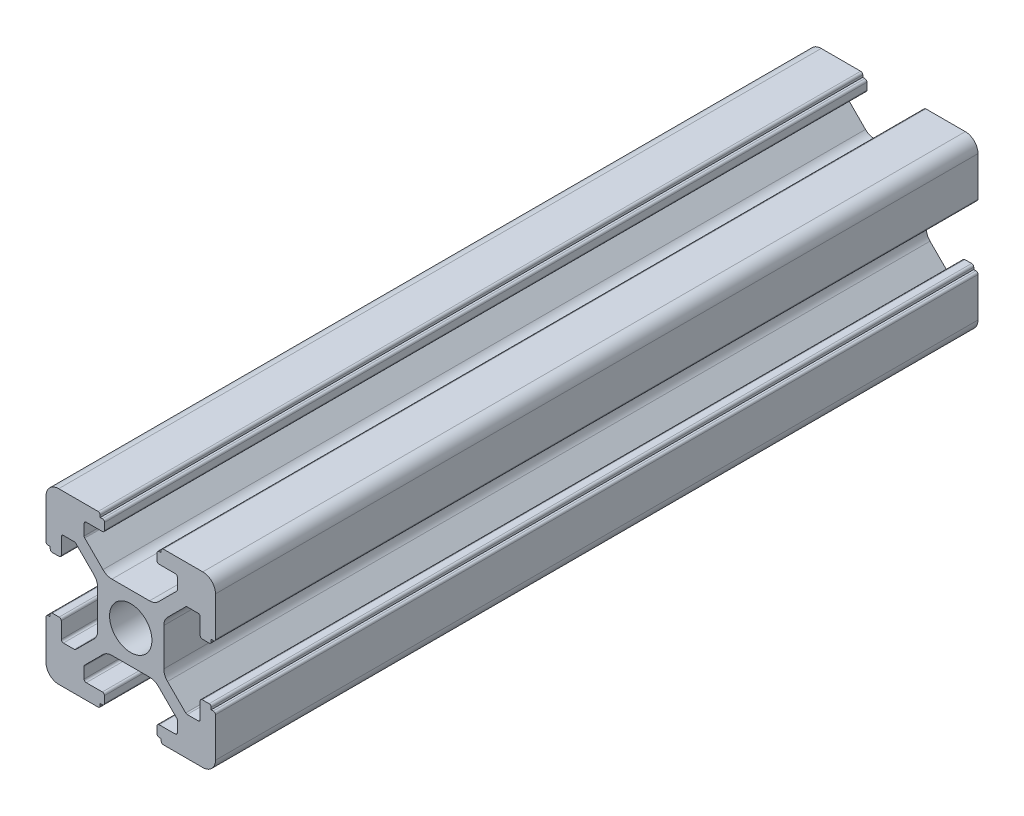
from build123d import *

# Parameters (mm, degrees)
SKETCH_1_R      = 2.5
EXTRUDE_1_DEPTH = 45


with BuildPart() as part:
    # 草图1 → 凸台-拉伸1 (new, symmetric)
    with BuildSketch(Plane.XY):
        with BuildLine():
            Line((-8.502261885, -10.002261885), (-3.85, -10.002261885))
            ThreePointArc((-3.85, -10.002261885), (-3.673223305, -9.929038581), (-3.6, -9.752261885))
            Line((-3.6, -9.752261885), (-3.6, -9.502261885))
            Line((-3.6, -9.502261885), (-3.35, -9.502261885))
            ThreePointArc((-3.35, -9.502261885), (-3.173223305, -9.429038581), (-3.1, -9.252261885))
            Line((-3.1, -9.252261885), (-3.1, -8.45))
            ThreePointArc((-3.1, -8.45), (-3.173223305, -8.273223305), (-3.35, -8.2))
            Line((-3.35, -8.2), (-5.25, -8.2))
            ThreePointArc((-5.25, -8.2), (-5.426776695, -8.126776695), (-5.5, -7.95))
            Line((-5.5, -7.95), (-5.5, -6.664213562))
            ThreePointArc((-5.5, -6.664213562), (-5.480969883, -6.568542704), (-5.426776695, -6.487436867))
            Line((-5.426776695, -6.487436867), (-3.278679656, -4.339339828))
            ThreePointArc((-3.278679656, -4.339339828), (-2.792044633, -4.014180701), (-2.218019485, -3.9))
            Line((-2.218019485, -3.9), (2.218019485, -3.9))
            ThreePointArc((2.218019485, -3.9), (2.792044633, -4.014180701), (3.278679656, -4.339339828))
            Line((3.278679656, -4.339339828), (5.426776695, -6.487436867))
            ThreePointArc((5.426776695, -6.487436867), (5.480969883, -6.568542704), (5.5, -6.664213562))
            Line((5.5, -6.664213562), (5.5, -7.95))
            ThreePointArc((5.5, -7.95), (5.426776695, -8.126776695), (5.25, -8.2))
            Line((5.25, -8.2), (3.35, -8.2))
            ThreePointArc((3.35, -8.2), (3.173223305, -8.273223305), (3.1, -8.45))
            Line((3.1, -8.45), (3.1, -9.252261885))
            ThreePointArc((3.1, -9.252261885), (3.173223305, -9.429038581), (3.35, -9.502261885))
            Line((3.35, -9.502261885), (3.6, -9.502261885))
            Line((3.6, -9.502261885), (3.6, -9.752261885))
            ThreePointArc((3.6, -9.752261885), (3.673223305, -9.929038581), (3.85, -10.002261885))
            Line((3.85, -10.002261885), (8.502261885, -10.002261885))
            ThreePointArc((8.502261885, -10.002261885), (9.562922057, -9.562922057), (10.002261885, -8.502261885))
            Line((10.002261885, -8.502261885), (10.002261885, -3.85))
            ThreePointArc((10.002261885, -3.85), (9.929038581, -3.673223305), (9.752261885, -3.6))
            Line((9.752261885, -3.6), (9.502261885, -3.6))
            Line((9.502261885, -3.6), (9.502261885, -3.35))
            ThreePointArc((9.502261885, -3.35), (9.429038581, -3.173223305), (9.252261885, -3.1))
            Line((9.252261885, -3.1), (8.45, -3.1))
            ThreePointArc((8.45, -3.1), (8.273223305, -3.173223305), (8.2, -3.35))
            Line((8.2, -3.35), (8.2, -5.25))
            ThreePointArc((8.2, -5.25), (8.126776695, -5.426776695), (7.95, -5.5))
            Line((7.95, -5.5), (6.664213562, -5.5))
            ThreePointArc((6.664213562, -5.5), (6.568542704, -5.480969883), (6.487436867, -5.426776695))
            Line((6.487436867, -5.426776695), (4.339339828, -3.278679656))
            ThreePointArc((4.339339828, -3.278679656), (4.014180701, -2.792044633), (3.9, -2.218019485))
            Line((3.9, -2.218019485), (3.9, 2.218019485))
            ThreePointArc((3.9, 2.218019485), (4.014180701, 2.792044633), (4.339339828, 3.278679656))
            Line((4.339339828, 3.278679656), (6.487436867, 5.426776695))
            ThreePointArc((6.487436867, 5.426776695), (6.568542704, 5.480969883), (6.664213562, 5.5))
            Line((6.664213562, 5.5), (7.95, 5.5))
            ThreePointArc((7.95, 5.5), (8.126776695, 5.426776695), (8.2, 5.25))
            Line((8.2, 5.25), (8.2, 3.35))
            ThreePointArc((8.2, 3.35), (8.273223305, 3.173223305), (8.45, 3.1))
            Line((8.45, 3.1), (9.252261885, 3.1))
            ThreePointArc((9.252261885, 3.1), (9.429038581, 3.173223305), (9.502261885, 3.35))
            Line((9.502261885, 3.35), (9.502261885, 3.6))
            Line((9.502261885, 3.6), (9.752261885, 3.6))
            ThreePointArc((9.752261885, 3.6), (9.929038581, 3.673223305), (10.002261885, 3.85))
            Line((10.002261885, 3.85), (10.002261885, 8.502261885))
            ThreePointArc((10.002261885, 8.502261885), (9.562922057, 9.562922057), (8.502261885, 10.002261885))
            Line((8.502261885, 10.002261885), (3.85, 10.002261885))
            ThreePointArc((3.85, 10.002261885), (3.673223305, 9.929038581), (3.6, 9.752261885))
            Line((3.6, 9.752261885), (3.6, 9.502261885))
            Line((3.6, 9.502261885), (3.35, 9.502261885))
            ThreePointArc((3.35, 9.502261885), (3.173223305, 9.429038581), (3.1, 9.252261885))
            Line((3.1, 9.252261885), (3.1, 8.45))
            ThreePointArc((3.1, 8.45), (3.173223305, 8.273223305), (3.35, 8.2))
            Line((3.35, 8.2), (5.25, 8.2))
            ThreePointArc((5.25, 8.2), (5.426776695, 8.126776695), (5.5, 7.95))
            Line((5.5, 7.95), (5.5, 6.664213562))
            ThreePointArc((5.5, 6.664213562), (5.480969883, 6.568542704), (5.426776695, 6.487436867))
            Line((5.426776695, 6.487436867), (3.278679656, 4.339339828))
            ThreePointArc((3.278679656, 4.339339828), (2.792044633, 4.014180701), (2.218019485, 3.9))
            Line((2.218019485, 3.9), (-2.218019485, 3.9))
            ThreePointArc((-2.218019485, 3.9), (-2.792044633, 4.014180701), (-3.278679656, 4.339339828))
            Line((-3.278679656, 4.339339828), (-5.426776695, 6.487436867))
            ThreePointArc((-5.426776695, 6.487436867), (-5.480969883, 6.568542704), (-5.5, 6.664213562))
            Line((-5.5, 6.664213562), (-5.5, 7.95))
            ThreePointArc((-5.5, 7.95), (-5.426776695, 8.126776695), (-5.25, 8.2))
            Line((-5.25, 8.2), (-3.35, 8.2))
            ThreePointArc((-3.35, 8.2), (-3.173223305, 8.273223305), (-3.1, 8.45))
            Line((-3.1, 8.45), (-3.1, 9.252261885))
            ThreePointArc((-3.1, 9.252261885), (-3.173223305, 9.429038581), (-3.35, 9.502261885))
            Line((-3.35, 9.502261885), (-3.6, 9.502261885))
            Line((-3.6, 9.502261885), (-3.6, 9.752261885))
            ThreePointArc((-3.6, 9.752261885), (-3.673223305, 9.929038581), (-3.85, 10.002261885))
            Line((-3.85, 10.002261885), (-8.502261885, 10.002261885))
            ThreePointArc((-8.502261885, 10.002261885), (-9.562922057, 9.562922057), (-10.002261885, 8.502261885))
            Line((-10.002261885, 8.502261885), (-10.002261885, 3.85))
            ThreePointArc((-10.002261885, 3.85), (-9.929038581, 3.673223305), (-9.752261885, 3.6))
            Line((-9.752261885, 3.6), (-9.502261885, 3.6))
            Line((-9.502261885, 3.6), (-9.502261885, 3.35))
            ThreePointArc((-9.502261885, 3.35), (-9.429038581, 3.173223305), (-9.252261885, 3.1))
            Line((-9.252261885, 3.1), (-8.45, 3.1))
            ThreePointArc((-8.45, 3.1), (-8.273223305, 3.173223305), (-8.2, 3.35))
            Line((-8.2, 3.35), (-8.2, 5.25))
            ThreePointArc((-8.2, 5.25), (-8.126776695, 5.426776695), (-7.95, 5.5))
            Line((-7.95, 5.5), (-6.664213562, 5.5))
            ThreePointArc((-6.664213562, 5.5), (-6.568542704, 5.480969883), (-6.487436867, 5.426776695))
            Line((-6.487436867, 5.426776695), (-4.339339828, 3.278679656))
            ThreePointArc((-4.339339828, 3.278679656), (-4.014180701, 2.792044633), (-3.9, 2.218019485))
            Line((-3.9, 2.218019485), (-3.9, -2.218019485))
            ThreePointArc((-3.9, -2.218019485), (-4.014180701, -2.792044633), (-4.339339828, -3.278679656))
            Line((-4.339339828, -3.278679656), (-6.487436867, -5.426776695))
            ThreePointArc((-6.487436867, -5.426776695), (-6.568542704, -5.480969883), (-6.664213562, -5.5))
            Line((-6.664213562, -5.5), (-7.95, -5.5))
            ThreePointArc((-7.95, -5.5), (-8.126776695, -5.426776695), (-8.2, -5.25))
            Line((-8.2, -5.25), (-8.2, -3.35))
            ThreePointArc((-8.2, -3.35), (-8.273223305, -3.173223305), (-8.45, -3.1))
            Line((-8.45, -3.1), (-9.252261885, -3.1))
            ThreePointArc((-9.252261885, -3.1), (-9.429038581, -3.173223305), (-9.502261885, -3.35))
            Line((-9.502261885, -3.35), (-9.502261885, -3.6))
            Line((-9.502261885, -3.6), (-9.752261885, -3.6))
            ThreePointArc((-9.752261885, -3.6), (-9.929038581, -3.673223305), (-10.002261885, -3.85))
            Line((-10.002261885, -3.85), (-10.002261885, -8.502261885))
            ThreePointArc((-10.002261885, -8.502261885), (-9.562922057, -9.562922057), (-8.502261885, -10.002261885))
        make_face()
        with Locations(Location((0, 0, 0), (0, 0, 180))):
            Circle(SKETCH_1_R, mode=Mode.SUBTRACT)
    extrude(amount=EXTRUDE_1_DEPTH, both=True)


solid = part.part
